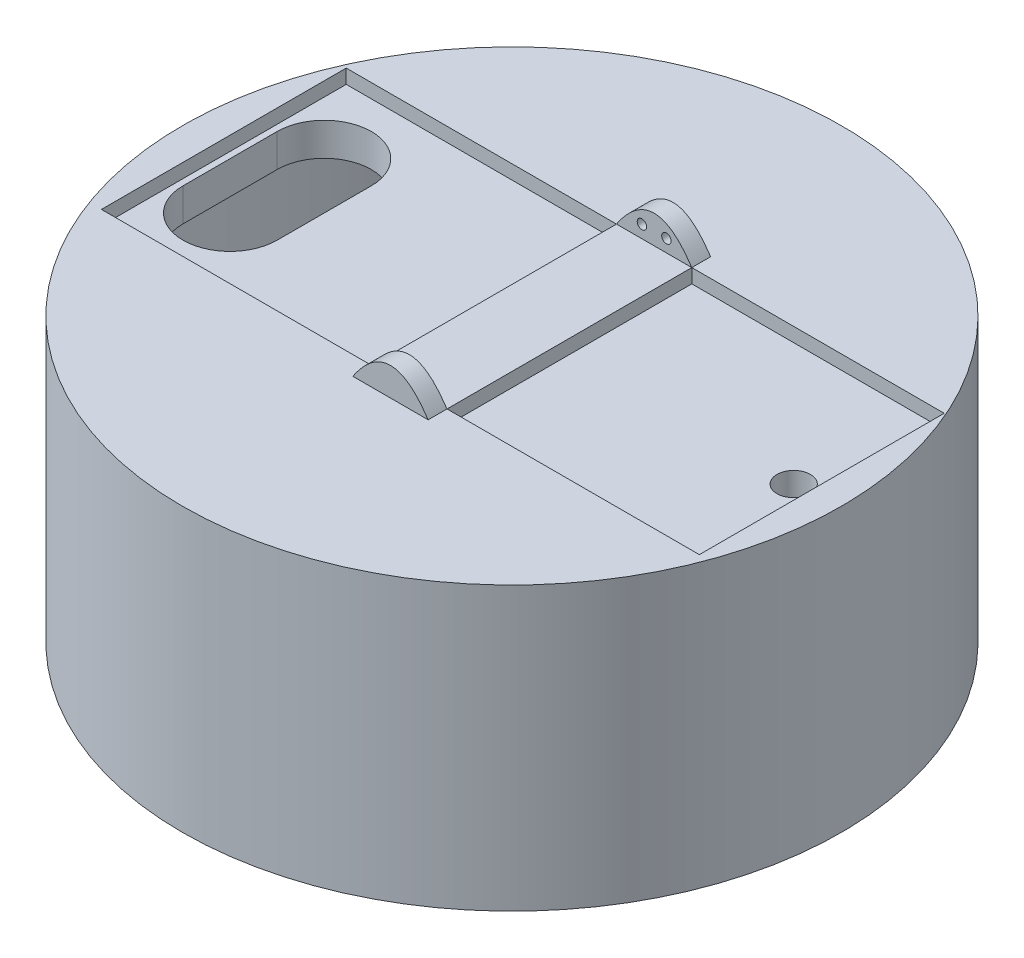
from build123d import *

# Parameters (mm, degrees)
SKETCH1_R               = 35
BOSS_EXTRUDE1_DEPTH     = 30
SKETCH2_R               = 33
CUT_EXTRUDE1_DEPTH      = 25
BOSS_EXTRUDE3_DEPTH     = 2
LPATTERN1_COUNT         = 2
LPATTERN1_PITCH         = 28
CUT_EXTRUDE2_DEPTH      = 14
CUT_EXTRUDE2_DEPTH_BACK = 14
SKETCH6_R               = 0.5
SKETCH7_W               = 28.7
SKETCH7_H               = 26
SKETCH7_W_2             = 26.8
CUT_EXTRUDE3_DEPTH      = 1.5
CUT_EXTRUDE4_DEPTH      = 7
SKETCH9_R               = 1.775668735
CUT_EXTRUDE5_DEPTH      = 7
SWEEP1_PITCH            = 5
SWEEP1_HEIGHT           = 10
SWEEP1_RADIUS           = 33
SWEEP1_START_ANGLE      = 45


with BuildPart() as part:
    # Sketch1 → Boss-Extrude1 (new body)
    with BuildSketch(Plane(origin=(0, 0, 0), x_dir=(1, 0, 0), z_dir=(0, 1, 0))):
        with Locations(Location((0, 0, 0), (0, 0, 270))):
            Circle(SKETCH1_R)
    extrude(amount=BOSS_EXTRUDE1_DEPTH)

    # Sketch2 → Cut-Extrude1 (cut)
    with BuildSketch(Plane(origin=(0, 0, 0), x_dir=(-1, 0, 0), z_dir=(0, -1, 0))):
        with Locations(Location((0, 0, 0), (0, 0, 90))):
            Circle(SKETCH2_R)
    extrude(amount=-CUT_EXTRUDE1_DEPTH, mode=Mode.SUBTRACT)

    # Sketch4 → Boss-Extrude3 (add)
    with BuildSketch(Plane.XY.offset(-16)):
        with BuildLine():
            Line((-2.895149393, 30), (5.104850607, 30))
            add(Edge.make_bspline(
                [(-2.895149393, 30), (1.104850607, 36), (5.104850607, 30)],
                knots=[0, 0, 0, 1, 1, 1], degree=2))
        make_face()
    boss_extrude3 = extrude(amount=BOSS_EXTRUDE3_DEPTH)

    # LPattern1: Boss-Extrude3 ×2
    with Locations(*[(0, 0, i * LPATTERN1_PITCH) for i in range(1, LPATTERN1_COUNT)]):
        add(boss_extrude3)

    # Sketch6 → Cut-Extrude2 (cut, two sides: drawn at the far end of the back side and taken through both)
    with BuildSketch(Plane(origin=(0, 0, -1), x_dir=(-1, 0, 0), z_dir=(0, 0, -1)).offset(-CUT_EXTRUDE2_DEPTH_BACK)):
        with Locations(Location((0.195149393, 31.337744251, 0), (0, 0, 180))):
            Circle(SKETCH6_R)
        with Locations(Location((-2.404850607, 31.337744251, 0), (0, 0, 180))):
            Circle(SKETCH6_R)
    extrude(amount=CUT_EXTRUDE2_DEPTH + CUT_EXTRUDE2_DEPTH_BACK, mode=Mode.SUBTRACT)

    # Sketch7 → Cut-Extrude3 (cut)
    with BuildSketch(Plane(origin=(0, 30, 0), x_dir=(1, 0, 0), z_dir=(0, 1, 0))):
        with Locations((-17.245149393, 1)):
            Rectangle(SKETCH7_W, SKETCH7_H)
        with Locations((18.504850607, 1)):
            Rectangle(SKETCH7_W_2, SKETCH7_H)
    extrude(amount=-CUT_EXTRUDE3_DEPTH, mode=Mode.SUBTRACT)

    # Sketch8 → Cut-Extrude4 (cut)
    with BuildSketch(Plane(origin=(0, 30, 0), x_dir=(1, 0, 0), z_dir=(0, 1, 0))):
        with BuildLine():
            Line((-20.933413537, 6), (-20.933413537, -4))
            ThreePointArc((-20.933413537, -4), (-25.933413537, -9), (-30.933413537, -4))
            Line((-30.933413537, -4), (-30.933413537, 6))
            ThreePointArc((-30.933413537, 6), (-25.933413537, 11), (-20.933413537, 6))
        make_face()
    extrude(amount=-CUT_EXTRUDE4_DEPTH, mode=Mode.SUBTRACT)

    # Sketch9 → Cut-Extrude5 (cut)
    with BuildSketch(Plane(origin=(0, 30, 0), x_dir=(1, 0, 0), z_dir=(0, 1, 0))):
        with Locations(Location((28.92213272, 1, 0), (0, 0, 270))):
            Circle(SKETCH9_R)
    extrude(amount=-CUT_EXTRUDE5_DEPTH, mode=Mode.SUBTRACT)

    # Sweep1: sweep along a helix
    with BuildLine() as sweep1_path:
        add(Helix(SWEEP1_PITCH, SWEEP1_HEIGHT, SWEEP1_RADIUS, center=(0, 15, 0), direction=(0, -1, 0), lefthand=True, mode=Mode.PRIVATE).rotate(Axis((0, 15, 0), (0, -1, 0)), SWEEP1_START_ANGLE))
    # Sketch11 → Sweep1 (sweep)
    with BuildSketch(Plane(origin=(23.334523779, 15, -23.334523779), x_dir=(-0.7073122244204905, 0.024093370762451518, 0.706490570829251), z_dir=(-0.7069012782456529, -0.024107377072608925, -0.7069012782456552))):
        Polygon((-0.7, 2), (-0.7, -2), (1.3, -0.5), (1.3, 0.5), align=None)
    sweep(path=sweep1_path.line, is_frenet=True)


solid = part.part
